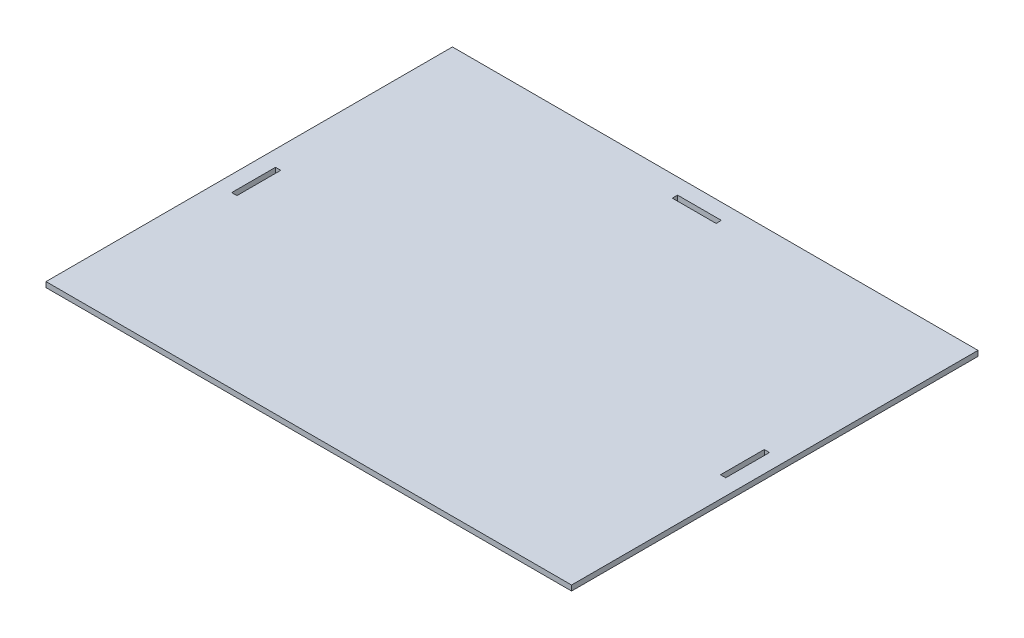
from build123d import *

# Parameters (mm, degrees)
SKETCH1_W           = 50
SKETCH1_H           = 6
SKETCH1_W_2         = 6
SKETCH1_H_2         = 50
BOSS_EXTRUDE1_DEPTH = 6


with BuildPart() as part:
    # Sketch1 → Boss-Extrude1 (new body)
    with BuildSketch(Plane(origin=(0, 0, 0), x_dir=(1, 0, 0), z_dir=(0, 1, 0))):
        Polygon((0, 0), (600, 0), (600, -464), (307, -464), (257, -464), (0, -464), align=None)
        with Locations((300, -21)):
            Rectangle(SKETCH1_W, SKETCH1_H, mode=Mode.SUBTRACT)
        with Locations((579, -245)):
            Rectangle(SKETCH1_W_2, SKETCH1_H_2, mode=Mode.SUBTRACT)
        with Locations((21, -245)):
            Rectangle(SKETCH1_W_2, SKETCH1_H_2, mode=Mode.SUBTRACT)
    extrude(amount=BOSS_EXTRUDE1_DEPTH)


solid = part.part
